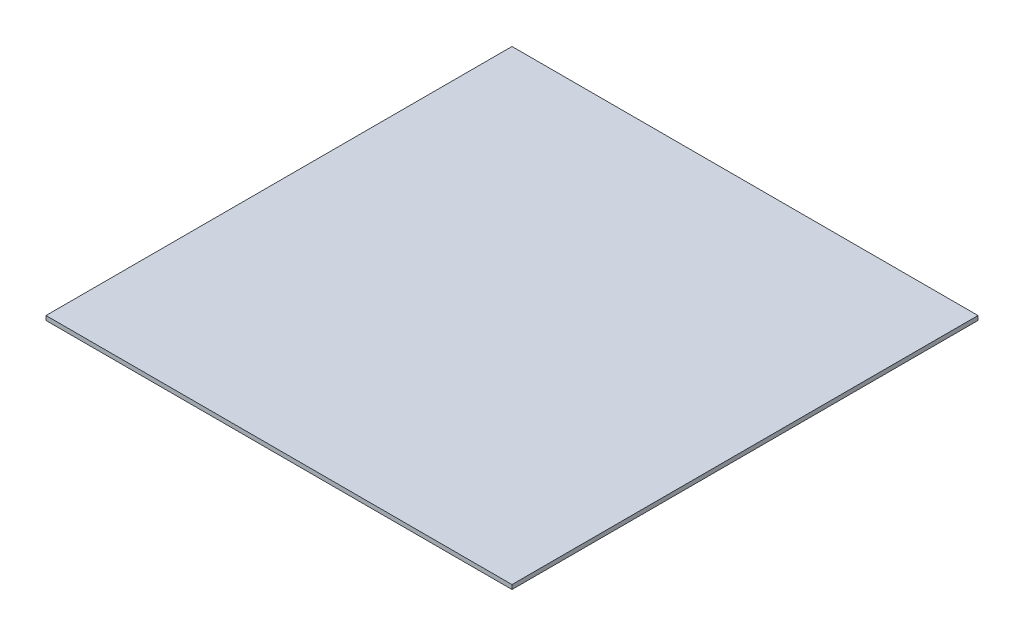
from build123d import *

# Parameters (mm, degrees)
SKETCH1_W           = 685.8
SKETCH1_H           = 685.8
BOSS_EXTRUDE1_DEPTH = 6.35


with BuildPart() as part:
    # Sketch1 → Boss-Extrude1 (new body)
    with BuildSketch(Plane(origin=(0, 0, 0), x_dir=(1, 0, 0), z_dir=(0, 1, 0))):
        with Locations((-342.9, 342.9)):
            Rectangle(SKETCH1_W, SKETCH1_H)
    extrude(amount=BOSS_EXTRUDE1_DEPTH)


solid = part.part
